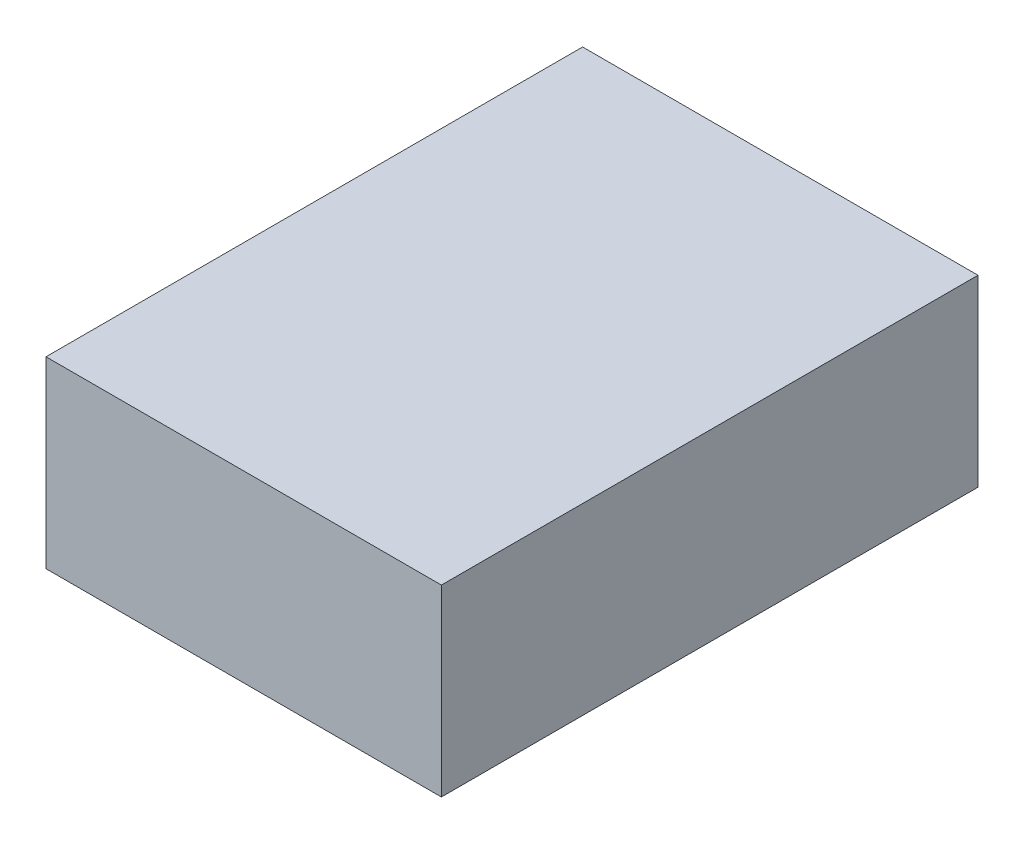
from build123d import *

# Parameters (mm, degrees)
SKETCH1_W           = 177.8
SKETCH1_H           = 241.3
BOSS_EXTRUDE1_DEPTH = 82.55


with BuildPart() as part:
    # Sketch1 → Boss-Extrude1 (new body)
    with BuildSketch(Plane(origin=(0, 0, 0), x_dir=(1, 0, 0), z_dir=(0, 1, 0))):
        Rectangle(SKETCH1_W, SKETCH1_H)
    extrude(amount=BOSS_EXTRUDE1_DEPTH)


solid = part.part
